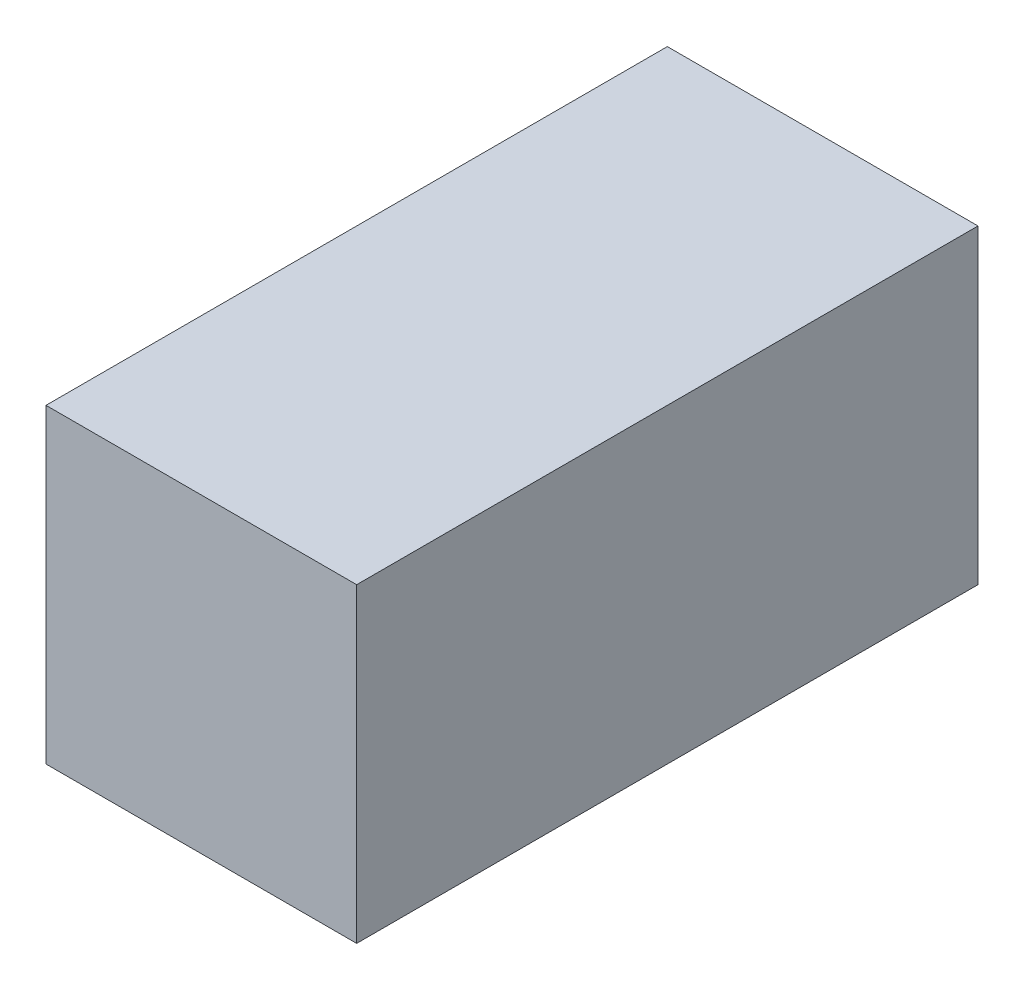
from build123d import *

# Parameters (mm, degrees)
SKETCH1_W           = 304.8
SKETCH1_H           = 304.8
BOSS_EXTRUDE1_DEPTH = 609.6


with BuildPart() as part:
    # Sketch1 → Boss-Extrude1 (new body)
    with BuildSketch(Plane.XY):
        Rectangle(SKETCH1_W, SKETCH1_H)
    extrude(amount=BOSS_EXTRUDE1_DEPTH)


solid = part.part
